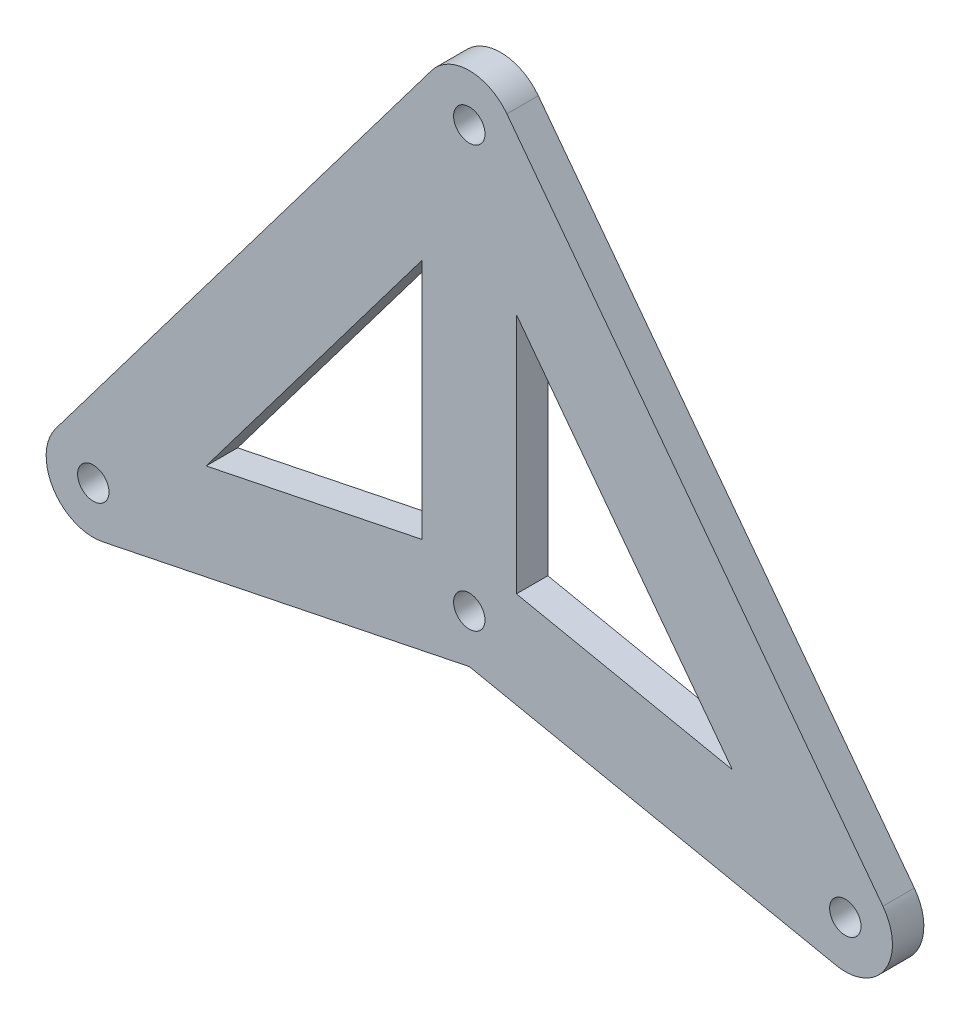
from build123d import *

# Parameters (mm, degrees)
BOSS_EXTRUDE2_START = -4.7625
SKETCH1_R           = 1.5875
BOSS_EXTRUDE2_DEPTH = 3.175


with BuildPart() as part:
    # Sketch1 → Boss-Extrude2 (new body)
    with BuildSketch(Plane.XY.offset(BOSS_EXTRUDE2_START)):
        with BuildLine():
            Line((-37.042399359, -12.465233892), (0, -4.861794023))
            Line((0, -4.861794023), (37.042399359, -12.465233892))
            ThreePointArc((37.042399359, -12.465233892), (42.026572193, -10.343250405), (41.801238825, -4.93085559))
            Line((41.801238825, -4.93085559), (3.801238825, 45.41414441))
            ThreePointArc((3.801238825, 45.41414441), (0, 47.3075), (-3.801238825, 45.41414441))
            Line((-3.801238825, 45.41414441), (-41.801238825, -4.93085559))
            ThreePointArc((-41.801238825, -4.93085559), (-42.026572193, -10.343250405), (-37.042399359, -12.465233892))
        make_face()
        with Locations((38, -7.8)):
            Circle(SKETCH1_R, mode=Mode.SUBTRACT)
        Circle(SKETCH1_R, mode=Mode.SUBTRACT)
        with Locations((-38, -7.8)):
            Circle(SKETCH1_R, mode=Mode.SUBTRACT)
        with Locations((0, 42.545)):
            Circle(SKETCH1_R, mode=Mode.SUBTRACT)
        Polygon((-4.7625, 3.884228234), (-4.7625, 28.330028455), (-26.596802701, -0.597549689), align=None, mode=Mode.SUBTRACT)
        Polygon((4.7625, 3.884228234), (4.7625, 28.330028455), (26.596802701, -0.597549689), align=None, mode=Mode.SUBTRACT)
    extrude(amount=-BOSS_EXTRUDE2_DEPTH)


solid = part.part
